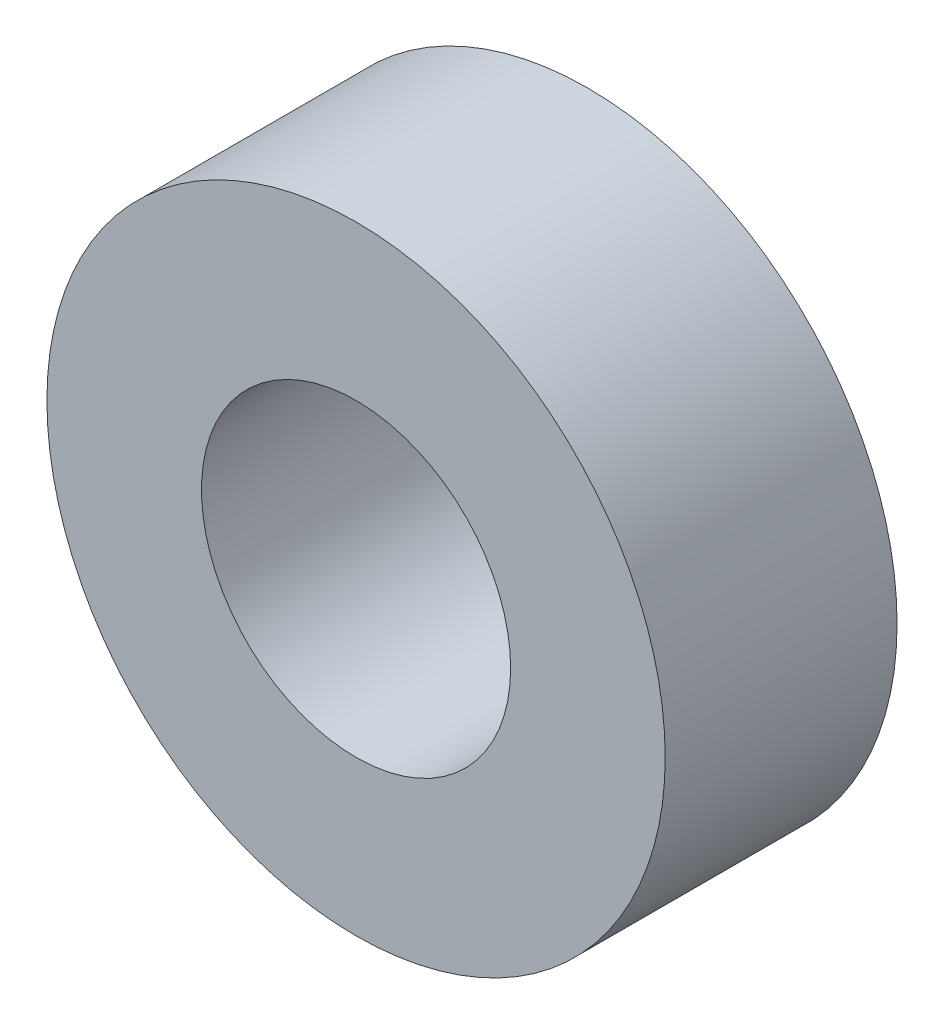
from build123d import *

# Parameters (mm, degrees)
SKETCH_1_R      = 4
SKETCH_1_R_2    = 2
EXTRUDE_1_DEPTH = 3


with BuildPart() as part:
    # 草图1 → 凸台-拉伸1 (new body)
    with BuildSketch(Plane.XY):
        Circle(SKETCH_1_R)
        Circle(SKETCH_1_R_2, mode=Mode.SUBTRACT)
    extrude(amount=EXTRUDE_1_DEPTH)


solid = part.part
